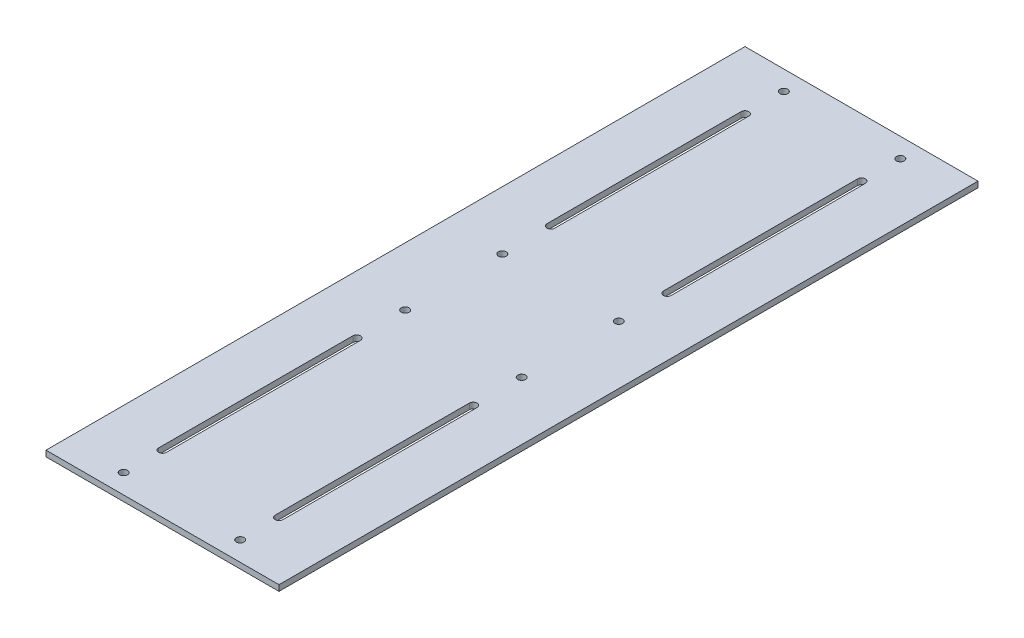
from build123d import *

# Parameters (mm, degrees)
SKETCH1_W           = 120
SKETCH1_H           = 360
BOSS_EXTRUDE1_DEPTH = 3
SKETCH2_R           = 2
CUT_EXTRUDE2_DEPTH  = 190.76037521
CUT_EXTRUDE3_DEPTH  = 190.76037521


with BuildPart() as part:
    # Sketch1 → Boss-Extrude1 (new body)
    with BuildSketch(Plane(origin=(0, 0, 0), x_dir=(1, 0, 0), z_dir=(0, 1, 0))):
        Rectangle(SKETCH1_W, SKETCH1_H)
    extrude(amount=BOSS_EXTRUDE1_DEPTH)

    # Sketch2 → Cut-Extrude2 (cut, through all)
    with BuildSketch(Plane(origin=(0, 3, 0), x_dir=(1, 0, 0), z_dir=(0, 1, 0))):
        with Locations(Location((-30, 170, 0), (0, 0, 270))):
            Circle(SKETCH2_R)
        with Locations(Location((30, 170, 0), (0, 0, 270))):
            Circle(SKETCH2_R)
        with Locations(Location((-30, -170, 0), (0, 0, 270))):
            Circle(SKETCH2_R)
        with Locations(Location((30, -170, 0), (0, 0, 270))):
            Circle(SKETCH2_R)
        with Locations(Location((-30, 25, 0), (0, 0, 270))):
            Circle(SKETCH2_R)
        with Locations(Location((30, 25, 0), (0, 0, 270))):
            Circle(SKETCH2_R)
        with Locations(Location((-30, -25, 0), (0, 0, 270))):
            Circle(SKETCH2_R)
        with Locations(Location((30, -25, 0), (0, 0, 270))):
            Circle(SKETCH2_R)
    extrude(amount=-CUT_EXTRUDE2_DEPTH, mode=Mode.SUBTRACT)

    # Sketch3 → Cut-Extrude3 (cut, through all)
    with BuildSketch(Plane(origin=(0, 3, 0), x_dir=(1, 0, 0), z_dir=(0, 1, 0))):
        with BuildLine():
            Line((32, 150), (32, 50))
            ThreePointArc((32, 50), (30, 48), (28, 50))
            Line((28, 50), (28, 150))
            ThreePointArc((28, 150), (30, 152), (32, 150))
        make_face()
        with BuildLine():
            Line((-28, 150), (-28, 50))
            ThreePointArc((-28, 50), (-30, 48), (-32, 50))
            Line((-32, 50), (-32, 150))
            ThreePointArc((-32, 150), (-30, 152), (-28, 150))
        make_face()
        with BuildLine():
            Line((28, -150), (28, -50))
            ThreePointArc((28, -50), (30, -48), (32, -50))
            Line((32, -50), (32, -150))
            ThreePointArc((32, -150), (30, -152), (28, -150))
        make_face()
        with BuildLine():
            Line((-32, -150), (-32, -50))
            ThreePointArc((-32, -50), (-30, -48), (-28, -50))
            Line((-28, -50), (-28, -150))
            ThreePointArc((-28, -150), (-30, -152), (-32, -150))
        make_face()
    extrude(amount=-CUT_EXTRUDE3_DEPTH, mode=Mode.SUBTRACT)


solid = part.part
